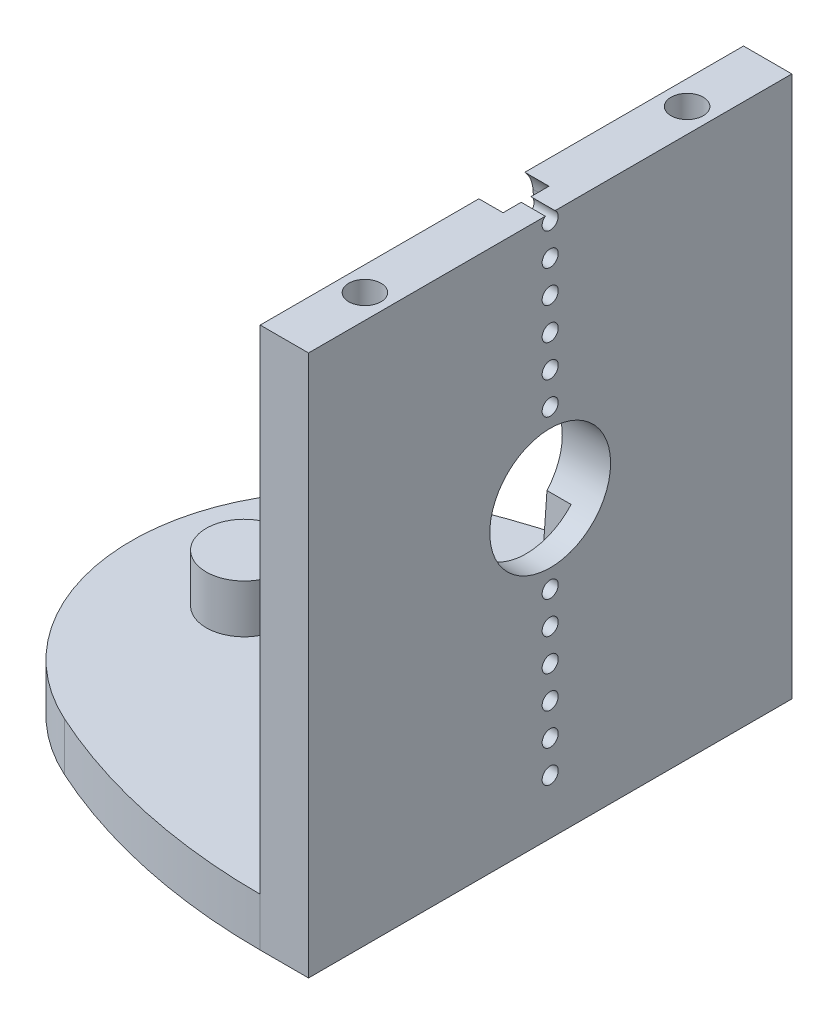
from build123d import *

# Parameters (mm, degrees)
BOSS_EXTRUDE1_DEPTH          = 3
BOSS_EXTRU_1_DEPTH           = 30.6
ESQUISSE2_R                  = 1.0000000000000018
ENL_V_MAT_EXTRU_1_DEPTH      = 3
ESQUISSE3_R                  = 2.349999999999996
BOSS_EXTRU_2_DEPTH           = 3
ESQUISSE4_R                  = 2.5
ENL_V_MAT_EXTRU_2_DEPTH      = 42.11398788733586
ENL_V_MAT_EXTRU_3_DEPTH      = 5
ENL_V_MAT_EXTRU_3_DEPTH_BACK = 1.5
ESQUISSE6_R                  = 0.4999999999999987
ESQUISSE6_R_2                = 0.5000000000000008
ESQUISSE6_R_3                = 0.49999999999999967
ESQUISSE6_R_4                = 3.749999999999999
ENL_V_MAT_EXTRU_4_DEPTH      = 3


with BuildPart() as part:
    # Sketch1 → Boss-Extrude1 (new body)
    with BuildSketch(Plane(origin=(0, 0, 0), x_dir=(1, 0, 0), z_dir=(0, 1, 0))):
        with BuildLine():
            Line((19, 15), (16.00000000000001, 15))
            ThreePointArc((16.00000000000001, 15.000000000000007), (8.070475080311514, 14.151517110035783), (0.5000000000000107, 11.644487847162011))
            ThreePointArc((0.5000000000000098, 11.64448784716201), (-6.999999999999976, -4.4e-16), (0.5000000000000098, -11.644487847162011))
            ThreePointArc((0.5000000000000107, -11.644487847162011), (8.070475080311514, -14.151517110035783), (16.00000000000001, -15.000000000000007))
            Line((16.00000000000001, -15), (19, -15))
            Line((19, -15), (19, 15))
        make_face()
    extrude(amount=-BOSS_EXTRUDE1_DEPTH)

    # Esquisse1 → Boss.-Extru.1 (add)
    with BuildSketch(Plane(origin=(0, 0, 0), x_dir=(1, 0, 0), z_dir=(0, 1, 0))):
        Polygon((19, 15), (16.000000000000007, 15), (16.00000000000001, -15), (19.000000000000004, -15), align=None)
    extrude(amount=BOSS_EXTRU_1_DEPTH)

    # Esquisse2 → Enlèv. mat.-Extru.1 (cut)
    with BuildSketch(Plane(origin=(0, 30.6, 0), x_dir=(1, 0, 0), z_dir=(0, 1, 0))):
        with Locations(Location((17.500000000000004, 10, 0), (0, 0, 270))):
            Circle(ESQUISSE2_R)
        with Locations(Location((17.500000000000004, -10, 0), (0, 0, 270))):
            Circle(ESQUISSE2_R)
    extrude(amount=-ENL_V_MAT_EXTRU_1_DEPTH, mode=Mode.SUBTRACT)

    # Esquisse3 → Boss.-Extru.2 (add)
    with BuildSketch(Plane(origin=(0, 0, 0), x_dir=(1, 0, 0), z_dir=(0, 1, 0))):
        with Locations(Location((0, 0, 0), (0, 0, 270))):
            Circle(ESQUISSE3_R)
    extrude(amount=BOSS_EXTRU_2_DEPTH)

    # Esquisse4 → Enlèv. mat.-Extru.2 (cut, through all)
    with BuildSketch(Plane.ZY.offset(-16.000000000000007)):
        with Locations((0, 15.3)):
            Circle(ESQUISSE4_R)
    extrude(amount=-ENL_V_MAT_EXTRU_2_DEPTH, mode=Mode.SUBTRACT)

    # Esquisse5 → Enlèv. mat.-Extru.3 (cut, two sides: drawn at the far end of the back side and taken through both)
    with BuildSketch(Plane.ZY.offset(-16.000000000000007).offset(-ENL_V_MAT_EXTRU_3_DEPTH_BACK)):
        with BuildLine():
            Line((-2.8000000000001206, 12.805506063347845), (-1.9323091258538179, 1.1685931981230362))
            add(Edge.make_bspline(
                [(-1.9323091258538179, 1.1685931981230362), (-1.9048352156569601, 0.8027138716048543), (-1.7460527055675423, 0.47250804579621575), (-1.5874431867330887, 0.14266197447294557), (-1.3185847338688517, -0.10715488116746878), (-1.0505560477953044, -0.3562007373159315), (-0.7091686681940543, -0.4905620157021409), (-0.3678310237411564, -0.6249037196151552), (-1.5634e-13, -0.6249999999988765), (0.3661752794111309, -0.6250958469887595), (0.7080076723836786, -0.4910181757340655), (1.0487343876149366, -0.35737418689144385), (1.3178512419643233, -0.1078357174129213), (1.5861375320152837, 0.14093261173257243), (1.745511479884174, 0.4713841828126921), (1.9047478532446405, 0.8015505020492266), (1.932309125853515, 1.1685931981230258)],
                knots=[0, 0, 0, 0.125, 0.125, 0.25, 0.25, 0.375, 0.375, 0.5, 0.5, 0.625, 0.625, 0.75, 0.75, 0.875, 0.875, 1, 1, 1], degree=2))
            Line((1.932309125853515, 1.1685931981230258), (2.7999999999998786, 12.80550606334783))
            ThreePointArc((2.7999999999998786, 12.80550606334783), (3.7499999999998854, 15.300000000001111), (2.799999999999892, 17.794493936654398))
            Line((2.799999999999892, 17.794493936654398), (1.9323091258535894, 29.43140680187921))
            add(Edge.make_bspline(
                [(1.9323091258535894, 29.43140680187921), (1.9048352156568606, 29.797286128395676), (1.746052705567315, 30.12749195420603), (1.587443186734994, 30.45733802552631), (1.318584733868623, 30.70715488116971), (1.0505560477969664, 30.956200737317417), (0.7091686681938255, 31.090562015704386), (0.36783102373777693, 31.224903719618656), (-7.308e-14, 31.225000000001117), (-0.36617527942078804, 31.22509584698975), (-0.7080076723839066, 31.091018175736306), (-1.0487343876225454, 30.957374186888348), (-1.3178512419645536, 30.70783571741516), (-1.586137532016866, 30.45906738826691), (-1.745511479884403, 30.128615817189548), (-1.9047478532448734, 29.798449497952962), (-1.932309125853744, 29.431406801879216)],
                knots=[0, 0, 0, 0.125, 0.125, 0.25, 0.25, 0.375, 0.375, 0.5, 0.5, 0.625, 0.625, 0.75, 0.75, 0.875, 0.875, 1, 1, 1], degree=2))
            Line((-1.932309125853744, 29.431406801879216), (-2.8000000000001077, 17.794493936654412))
            ThreePointArc((-2.8000000000001077, 17.794493936654412), (-3.7500000000001132, 15.300000000001132), (-2.8000000000001206, 12.805506063347845))
        make_face()
    extrude(amount=ENL_V_MAT_EXTRU_3_DEPTH + ENL_V_MAT_EXTRU_3_DEPTH_BACK, mode=Mode.SUBTRACT)

    # Esquisse6 → Enlèv. mat.-Extru.4 (cut)
    with BuildSketch(Plane(origin=(19, 0, 0), x_dir=(0, 0, -1), z_dir=(1, 0, 0))):
        with Locations((7.86e-14, 30.20000000000113)):
            Circle(ESQUISSE6_R)
        with Locations((8.389e-14, 28.200000000001125)):
            Circle(ESQUISSE6_R)
        with Locations((8.917e-14, 26.200000000001125)):
            Circle(ESQUISSE6_R)
        with Locations((9.445e-14, 24.200000000001122)):
            Circle(ESQUISSE6_R_2)
        with Locations((9.974e-14, 22.200000000001125)):
            Circle(ESQUISSE6_R_3)
        with Locations((1.0502e-13, 20.200000000001125)):
            Circle(ESQUISSE6_R)
        with Locations((1.309e-13, 10.400000000001125)):
            Circle(ESQUISSE6_R_3)
        with Locations((1.3619e-13, 8.400000000001125)):
            Circle(ESQUISSE6_R_3)
        with Locations((1.4147e-13, 6.400000000001126)):
            Circle(ESQUISSE6_R_3)
        with Locations((1.4675e-13, 4.400000000001127)):
            Circle(ESQUISSE6_R_3)
        with Locations((1.5204e-13, 2.4000000000011252)):
            Circle(ESQUISSE6_R_3)
        with Locations((1.5732e-13, 0.4000000000011234)):
            Circle(ESQUISSE6_R_3)
        with Locations((1.1848e-13, 15.300000000001125)):
            Circle(ESQUISSE6_R_4)
    extrude(amount=-ENL_V_MAT_EXTRU_4_DEPTH, mode=Mode.SUBTRACT)


solid = part.part
